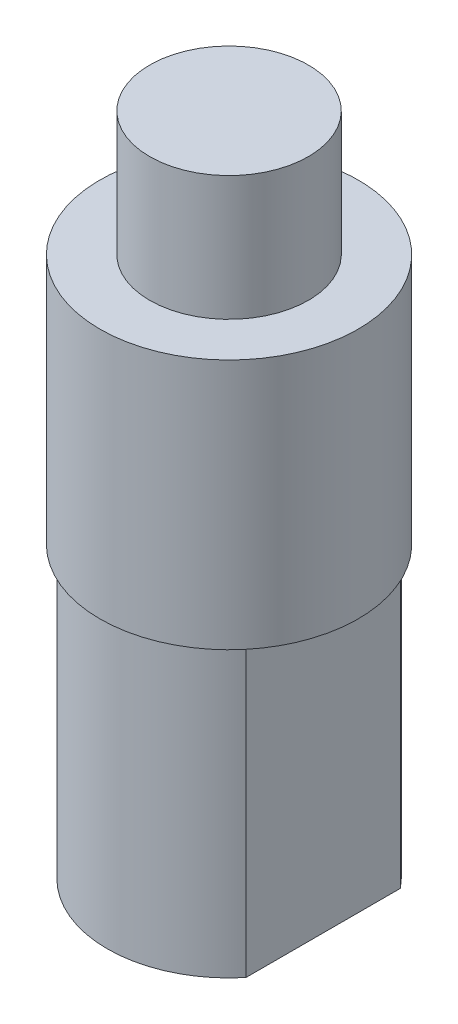
from build123d import *

# Parameters (mm, degrees)
SKETCH1_R           = 8.3
BOSS_EXTRUDE1_DEPTH = 16.125
SKETCH2_R           = 5.1
BOSS_EXTRUDE2_DEPTH = 8
BOSS_EXTRUDE3_DEPTH = 18.6


with BuildPart() as part:
    # Sketch1 → Boss-Extrude1 (new body)
    with BuildSketch(Plane(origin=(0, 0, 0), x_dir=(1, 0, 0), z_dir=(0, 1, 0))):
        with Locations(Location((0, 0, 0), (0, 0, 270))):
            Circle(SKETCH1_R)
    extrude(amount=-BOSS_EXTRUDE1_DEPTH)

    # Sketch2 → Boss-Extrude2 (add)
    with BuildSketch(Plane(origin=(0, 0, 0), x_dir=(1, 0, 0), z_dir=(0, 1, 0))):
        with Locations(Location((0, 0, 0), (0, 0, 270))):
            Circle(SKETCH2_R)
    extrude(amount=BOSS_EXTRUDE2_DEPTH)

    # Sketch3 → Boss-Extrude3 (add)
    with BuildSketch(Plane.XZ.offset(16.125)):
        with BuildLine():
            Line((-6.05, -4.962673171), (-6.05, 4.962673171))
            ThreePointArc((-6.05, 4.962673171), (0, 7.825), (6.05, 4.962673171))
            Line((6.05, 4.962673171), (6.05, -4.962673171))
            ThreePointArc((6.05, -4.962673171), (0, -7.825), (-6.05, -4.962673171))
        make_face()
    extrude(amount=BOSS_EXTRUDE3_DEPTH)


solid = part.part
